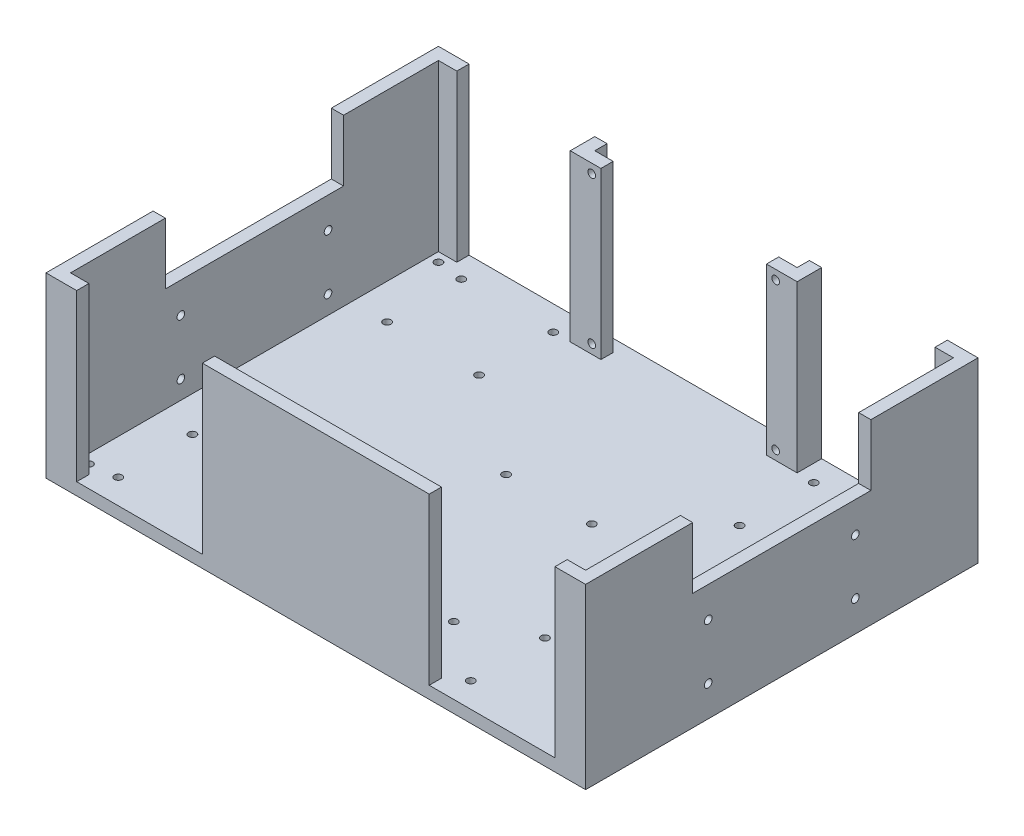
from build123d import *

# Parameters (mm, degrees)
SKETCH_1_W             = 176
SKETCH_1_H             = 128
EXTRUDE_1_DEPTH        = 58
SKETCH_2_W             = 168
SKETCH_2_H             = 120
CUT_EXTRUDE_1_DEPTH    = 54
SKETCH_3_W             = 41
SKETCH_3_H             = 54
CUT_EXTRUDE_2_DEPTH    = 226.219892549
SKETCH_5_W             = 58.134630982
SKETCH_5_H             = 20.010666667
CUT_EXTRUDE_4_DEPTH    = 226.219892549
HOLE_WIZARD_M3_1_D     = 2.5
HOLE_WIZARD_M3_2_D     = 2.5
SKETCH_15_W            = 74
SKETCH_15_H            = 8
EXTRUDE_2_DEPTH        = 54
CUT_EXTRUDE_5_DEPTH    = 54
HOLE_WIZARD_M3_4_D     = 2.5
HOLE_WIZARD_M3_4_DEPTH = 4


with BuildPart() as part:
    # 草图1 → 凸台-拉伸1 (new body)
    with BuildSketch(Plane(origin=(0, 0, 0), x_dir=(1, 0, 0), z_dir=(0, 1, 0))):
        with Locations((88, -64)):
            Rectangle(SKETCH_1_W, SKETCH_1_H)
    extrude(amount=EXTRUDE_1_DEPTH)

    # 草图2 → 切除-拉伸1 (cut)
    with BuildSketch(Plane(origin=(0, 58, 0), x_dir=(1, 0, 0), z_dir=(0, 1, 0))):
        with Locations((88, -64)):
            Rectangle(SKETCH_2_W, SKETCH_2_H)
    extrude(amount=-CUT_EXTRUDE_1_DEPTH, mode=Mode.SUBTRACT)

    # 草图3 → 切除-拉伸2 (cut, through all)
    with BuildSketch(Plane.XY.offset(128)):
        with Locations((30.5, 31)):
            Rectangle(SKETCH_3_W, SKETCH_3_H)
        with Locations((145.5, 31)):
            Rectangle(SKETCH_3_W, SKETCH_3_H)
    extrude(amount=-CUT_EXTRUDE_2_DEPTH, mode=Mode.SUBTRACT)

    # 草图5 → 切除-拉伸4 (cut, through all)
    with BuildSketch(Plane.ZY):
        with Locations((64, 47.994666667)):
            Rectangle(SKETCH_5_W, SKETCH_5_H)
    extrude(amount=-CUT_EXTRUDE_4_DEPTH, mode=Mode.SUBTRACT)

    # M3 螺纹孔1 (through all)
    with Locations(Plane.ZY):
        with Locations((40, 27.989333333), (88, 27.989333333), (88, 10), (40, 10)):
            Hole(HOLE_WIZARD_M3_1_D / 2)

    # M3 螺纹孔2 (through all)
    with Locations(Plane(origin=(0, 4, 0), x_dir=(1, 0, 0), z_dir=(0, 1, 0))):
        with Locations((7, -7), (15.5, -8.05), (15.5, -32.25), (45.5, -32.25), (45.5, -8.05), (15.5, -95.75), (15.5, -119.95), (7, -121), (45.5, -119.95), (45.5, -95.75), (130.5, -119.95), (160.5, -119.95), (160.5, -95.75), (130.5, -95.75), (169, -121), (169, -7), (160.5, -8.05), (160.5, -32.25), (130.5, -32.25), (130.5, -8.05), (105.95, -55.92), (111.03, -106), (62.77, -106), (78.01, -55.92)):
            Hole(HOLE_WIZARD_M3_2_D / 2)

    # 草图15 → 凸台-拉伸2 (add)
    with BuildSketch(Plane(origin=(0, 4, 0), x_dir=(1, 0, 0), z_dir=(0, 1, 0))):
        with Locations((88, -4)):
            Rectangle(SKETCH_15_W, SKETCH_15_H)
    extrude(amount=EXTRUDE_2_DEPTH)

    # 草图16 → 切除-拉伸5 (cut)
    with BuildSketch(Plane(origin=(0, 58, 0), x_dir=(1, 0, 0), z_dir=(0, 1, 0))):
        Polygon((55, 0), (55, -4), (61, -4), (61, -8), (115, -8), (115, -4), (121, -4), (121, 0), align=None)
    extrude(amount=-CUT_EXTRUDE_5_DEPTH, mode=Mode.SUBTRACT)

    # M3 螺纹孔4
    with Locations(Plane(origin=(0, 0, 4), x_dir=(-1, 0, 0), z_dir=(0, 0, -1))):
        with Locations((-118, 55), (-58, 55), (-58, 7), (-118, 7)):
            Hole(HOLE_WIZARD_M3_4_D / 2, depth=HOLE_WIZARD_M3_4_DEPTH)


solid = part.part
